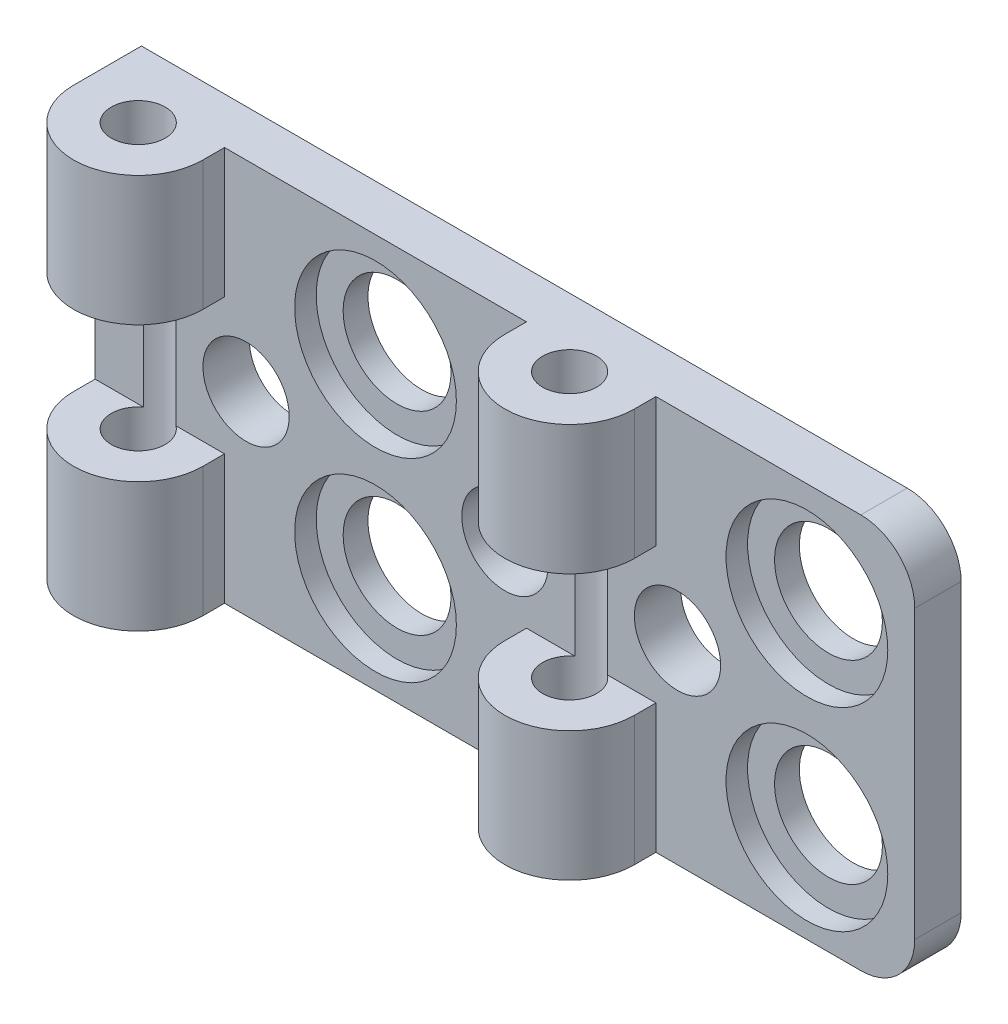
from build123d import *

# Parameters (mm, degrees)
SKETCH1_R             = 6
SKETCH1_R_2           = 2.501
BOSS_EXTRUDE1_DEPTH   = 36.6
BOSS_EXTRUDE1_2_DEPTH = 36.6
BOSS_EXTRUDE2_DEPTH   = 36.6
SKETCH2_R             = 5
CUT_EXTRUDE1_DEPTH    = 60.120639374
SKETCH6_W             = 28
SKETCH6_H             = 36.6
SKETCH6_R             = 7.5
SKETCH6_W_2           = 24
BOSS_EXTRUDE3_DEPTH   = 2
FILLET2_R             = 5
SKETCH7_R             = 4
CUT_EXTRUDE2_DEPTH    = 60.325879682
SKETCH8_W             = 12
SKETCH8_H             = 12.6
CUT_EXTRUDE3_DEPTH    = 60.325879682


with BuildPart() as part:
    # Sketch1 → Boss-Extrude1 (new body)
    with BuildSketch(Plane(origin=(0, 0, 0), x_dir=(1, 0, 0), z_dir=(0, 1, 0))):
        with Locations(Location((-40, 0, 0), (0, 0, 270))):
            Circle(SKETCH1_R)
        with Locations(Location((-40, 0, 0), (0, 0, 270))):
            Circle(SKETCH1_R_2, mode=Mode.SUBTRACT)
    extrude(amount=BOSS_EXTRUDE1_DEPTH)



with BuildPart() as body_2:
    # Sketch1 → Boss-Extrude1 2 (new body)
    with BuildSketch(Plane(origin=(0, 0, 0), x_dir=(1, 0, 0), z_dir=(0, 1, 0))):
        with Locations(Location((0, 0, 0), (0, 0, 270))):
            Circle(SKETCH1_R)
        with Locations(Location((0, 0, 0), (0, 0, 270))):
            Circle(SKETCH1_R_2, mode=Mode.SUBTRACT)
    extrude(amount=BOSS_EXTRUDE1_2_DEPTH)


with BuildPart() as part_1:
    add(part.part)

    add(body_2.part)  # Boss-Extrude2 merges body 2
    # Sketch3 → Boss-Extrude2 (add)
    with BuildSketch(Plane(origin=(0, 0, 0), x_dir=(1, 0, 0), z_dir=(0, 1, 0))):
        with BuildLine():
            Line((-34, 0), (-34, 4))
            Line((-34, 4), (-6, 4))
            Line((-6, 4), (-6, 0))
            ThreePointArc((-6, 0), (0, 6), (6, 0))
            Line((6, 0), (6, 4))
            Line((6, 4), (30, 4))
            Line((30, 4), (30, 6.3))
            Line((30, 6.3), (6, 6.3))
            Line((6, 6.3), (-46, 6.3))
            Line((-46, 6.3), (-46, 0))
            ThreePointArc((-46, 0), (-40, 6), (-34, 0))
        make_face()
    extrude(amount=BOSS_EXTRUDE2_DEPTH)

    # Sketch2 → Cut-Extrude1 (cut, through all)
    with BuildSketch(Plane.XY):
        with Locations((-20, 27)):
            Circle(SKETCH2_R)
        with Locations((-20, 9)):
            Circle(SKETCH2_R)
        with Locations((20, 27)):
            Circle(SKETCH2_R)
        with Locations((20, 9)):
            Circle(SKETCH2_R)
    extrude(amount=-CUT_EXTRUDE1_DEPTH, mode=Mode.SUBTRACT)

    # Sketch6 → Boss-Extrude3 (add)
    # profile 1 of 2: a face of its own
    with BuildSketch(Plane.XY.offset(-4)):
        with Locations((-20, 18.3)):
            Rectangle(SKETCH6_W, SKETCH6_H)
        with Locations((-20, 27)):
            Circle(SKETCH6_R, mode=Mode.SUBTRACT)
        with Locations((-20, 9)):
            Circle(SKETCH6_R, mode=Mode.SUBTRACT)
    # profile 2 of 2: a face of its own
    with BuildSketch(Plane.XY.offset(-4)):
        with Locations((18, 18.3)):
            Rectangle(SKETCH6_W_2, SKETCH6_H)
        with Locations((20, 27)):
            Circle(SKETCH6_R, mode=Mode.SUBTRACT)
        with Locations((20, 9)):
            Circle(SKETCH6_R, mode=Mode.SUBTRACT)
    extrude(amount=BOSS_EXTRUDE3_DEPTH)

    # Fillet2
    fillet2_edges = [part_1.edges().sort_by_distance(p)[0] for p in [
        (30, 36.6, -4.15),
        (30, 0, -4.15),
    ]]
    fillet(fillet2_edges, radius=FILLET2_R)

    # Sketch7 → Cut-Extrude2 (cut, through all)
    with BuildSketch(Plane.XY.offset(-2)):
        with Locations((-32, 18)):
            Circle(SKETCH7_R)
        with Locations((-8, 18)):
            Circle(SKETCH7_R)
        with Locations((8, 18)):
            Circle(SKETCH7_R)
    extrude(amount=-CUT_EXTRUDE2_DEPTH, mode=Mode.SUBTRACT)

    # Sketch8 → Cut-Extrude3 (cut, through all)
    with BuildSketch(Plane.XY.offset(-2)):
        with Locations((0, 18.3)):
            Rectangle(SKETCH8_W, SKETCH8_H)
        with Locations((-40, 18.3)):
            Rectangle(SKETCH8_W, SKETCH8_H)
    extrude(amount=CUT_EXTRUDE3_DEPTH, mode=Mode.SUBTRACT)


solid = part_1.part
